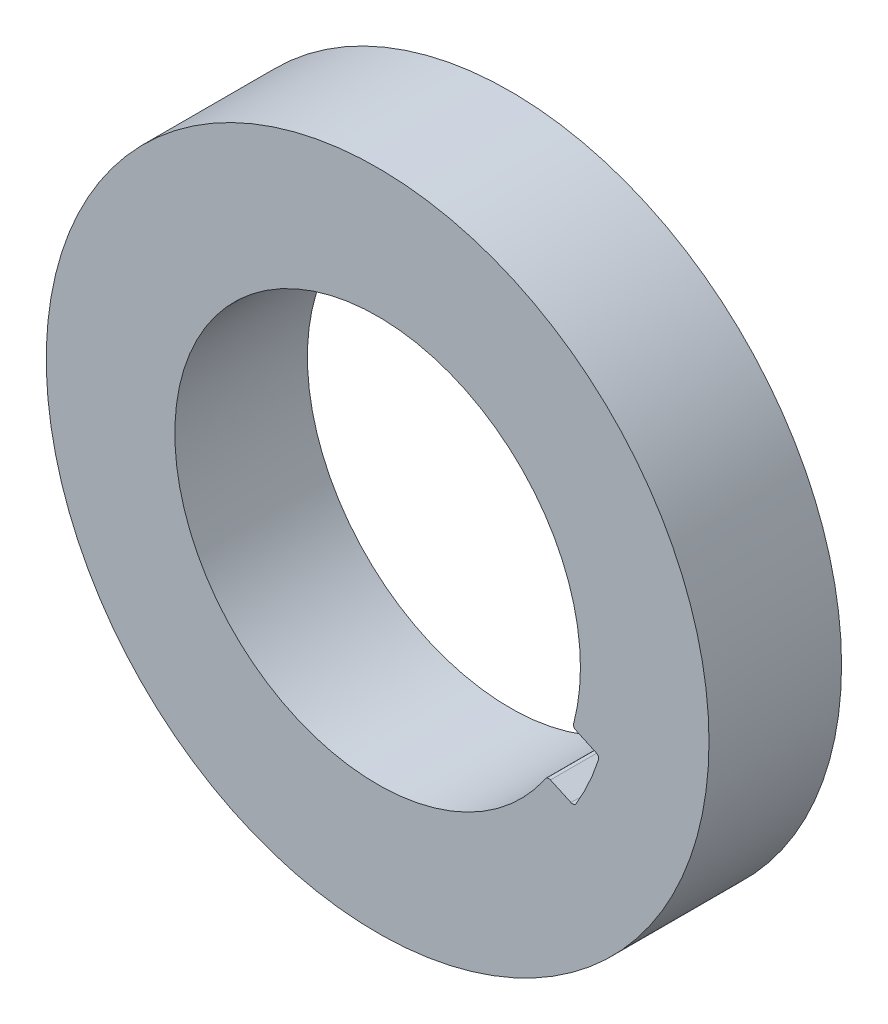
from build123d import *

# Parameters (mm, degrees)
ESQUISSE1_R        = 25
BOSS_EXTRU_1_DEPTH = 10


with BuildPart() as part:
    # Esquisse1 → Boss.-Extru.1 (new body)
    with BuildSketch(Plane.XY):
        Circle(ESQUISSE1_R)
        with BuildLine():
            Line((14.953030626, -4.277181575), (16.501758042, -4.982426557))
            ThreePointArc((16.501758042, -4.982426557), (16.651785463, -5.134087079), (16.663083329, -5.347116418))
            ThreePointArc((16.663083329, -5.347116418), (15.924531384, -7.256672806), (14.968008895, -9.066901881))
            ThreePointArc((14.968008895, -9.066901881), (14.799864591, -9.198133844), (14.587009397, -9.184458985))
            Line((14.587009397, -9.184458985), (13.038282108, -8.478683252))
            ThreePointArc((13.038282108, -8.478683252), (12.832759155, -8.462847948), (12.665533258, -8.583371557))
            ThreePointArc((12.665533258, -8.583371557), (-13.922503409, 6.344596033), (14.787409001, -3.927153556))
            ThreePointArc((14.787409001, -3.927153556), (14.806182583, -4.132467854), (14.953030626, -4.277181575))
        make_face(mode=Mode.SUBTRACT)
    extrude(amount=BOSS_EXTRU_1_DEPTH)


solid = part.part
